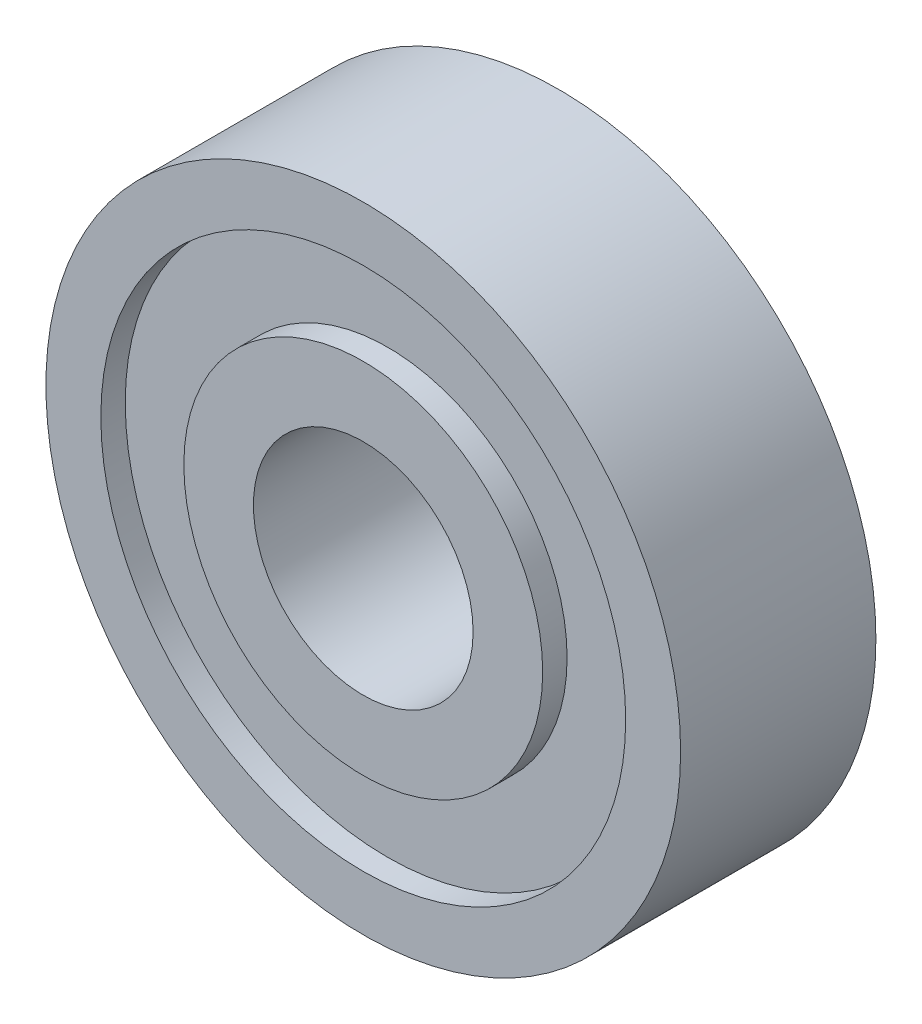
from build123d import *

# Parameters (mm, degrees)
SKETCH_1_R          = 13
SKETCH_1_R_2        = 4.5
EXTRUDE_1_DEPTH     = 8
SKETCH_2_R          = 10.75
SKETCH_2_R_2        = 7.35
CUT_EXTRUDE_1_DEPTH = 1
CUT_EXTRUDE_START   = -1
SKETCH_3_R          = 10.75
SKETCH_3_R_2        = 7.35
CUT_EXTRUDE_2_DEPTH = 1


with BuildPart() as part:
    # Эскиз1 → Бобышка-Вытянуть1 (new body)
    with BuildSketch(Plane.XY):
        Circle(SKETCH_1_R)
        Circle(SKETCH_1_R_2, mode=Mode.SUBTRACT)
    extrude(amount=EXTRUDE_1_DEPTH)

    # Эскиз2 → Вырез-Вытянуть1 (cut)
    with BuildSketch(Plane.XY.offset(8)):
        Circle(SKETCH_2_R)
        Circle(SKETCH_2_R_2, mode=Mode.SUBTRACT)
    extrude(amount=-CUT_EXTRUDE_1_DEPTH, mode=Mode.SUBTRACT)

    # Эскиз3 → Вырез-Вытянуть2 (cut)
    with BuildSketch(Plane(origin=(0, 0, 0), x_dir=(-1, 0, 0), z_dir=(0, 0, -1)).offset(CUT_EXTRUDE_START)):
        with Locations(Location((0, 0, 0), (0, 0, 180))):
            Circle(SKETCH_3_R)
        with Locations(Location((0, 0, 0), (0, 0, 180))):
            Circle(SKETCH_3_R_2, mode=Mode.SUBTRACT)
    extrude(amount=CUT_EXTRUDE_2_DEPTH, mode=Mode.SUBTRACT)


solid = part.part
